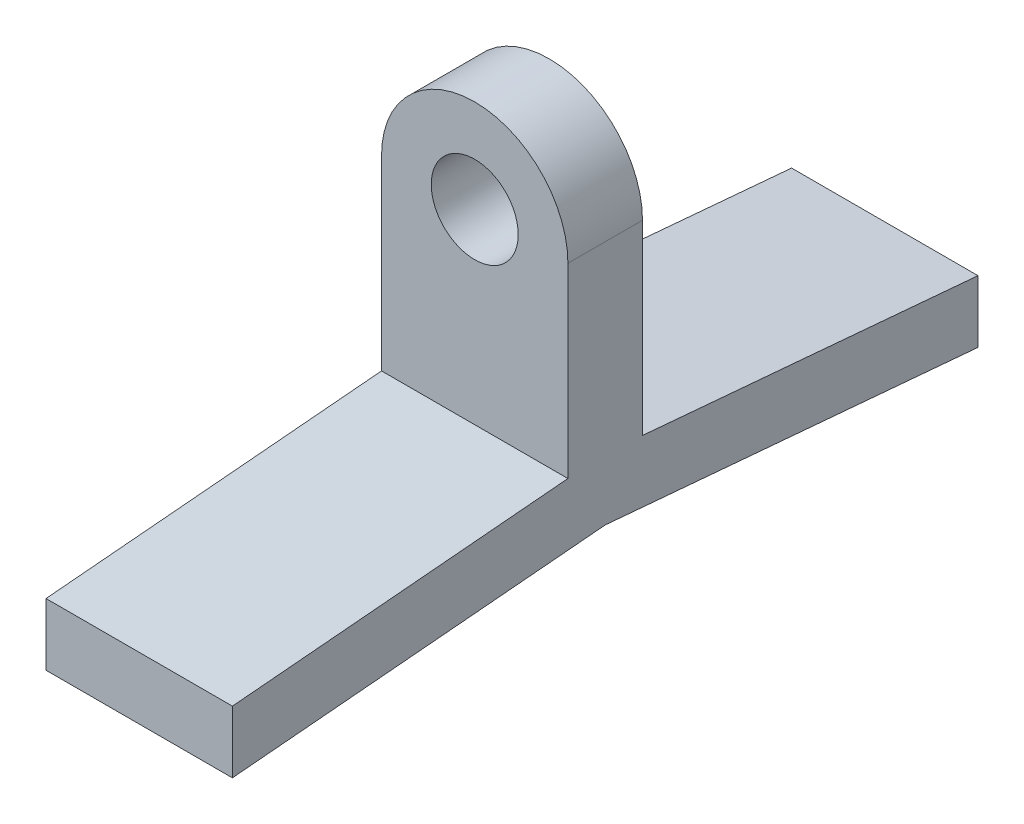
from build123d import *

# Parameters (mm, degrees)
SKETCH1_R           = 3.5
BOSS_EXTRUDE1_DEPTH = 6
BOSS_EXTRUDE2_DEPTH = 15


with BuildPart() as part:
    # Sketch1 → Boss-Extrude1 (new body)
    with BuildSketch(Plane.XY):
        with BuildLine():
            Line((-7.5, 0), (-7.5, -15))
            Line((-7.5, -15), (7.5, -15))
            Line((7.5, -15), (7.5, 0))
            ThreePointArc((7.5, 0), (0, 7.5), (-7.5, 0))
        make_face()
        Circle(SKETCH1_R, mode=Mode.SUBTRACT)
    extrude(amount=BOSS_EXTRUDE1_DEPTH)

    # Sketch2 → Boss-Extrude2 (add)
    with BuildSketch(Plane(origin=(7.5, 0, 0), x_dir=(0, 0, -1), z_dir=(1, 0, 0))):
        Polygon((-6, -15), (-33, -17.362193915), (-33, -22.362193915), (-3, -19.737534009), (27, -22.362193915), (27, -17.362193915), (0, -15), align=None)
    extrude(amount=-BOSS_EXTRUDE2_DEPTH)


solid = part.part
